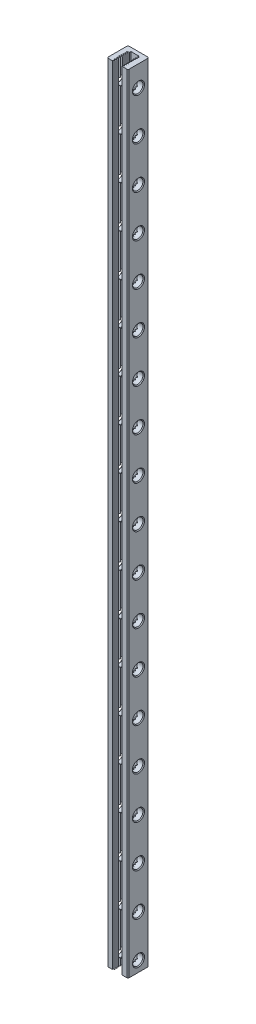
from build123d import *

# Parameters (mm, degrees)
SKETCH1_W                  = 8
SKETCH1_H                  = 8
BOSS_EXTRUDE1_DEPTH        = 300
CUT_EXTRUDE1_DEPTH         = 301.213257535
SKETCH3_R                  = 2
CUT_EXTRUDE2_DEPTH         = 301.213257535
CHAMFER1_SIZE              = 0.3
CHAMFER2_SIZE              = 0.3
LPATTERN1_COUNT            = 19
LPATTERN1_PITCH            = 16
CHAMFER1_OF_LPATTERN1_SIZE = 0.3


with BuildPart() as part:
    # Sketch1 → Boss-Extrude1 (new body)
    with BuildSketch(Plane(origin=(0, 0, 0), x_dir=(1, 0, 0), z_dir=(0, 1, 0))):
        with Locations((4, 4)):
            Rectangle(SKETCH1_W, SKETCH1_H)
    extrude(amount=BOSS_EXTRUDE1_DEPTH)

    # Sketch2 → Cut-Extrude1 (cut, through all)
    with BuildSketch(Plane.XZ):
        Polygon((5.652029979, 0), (2.008445554, 0), (2.008445554, -0.208206305), (2.54, -0.515099407), (1.673719601, -0.865099407), (2.54, -1.215099407), (1.673719601, -1.572712655), (2.54, -1.915099407), (1.673719601, -2.265099407), (2.54, -2.615099407), (1.673719601, -2.965099407), (2.54, -3.315099407), (1.673719601, -3.665099407), (2.54, -4.015099407), (1.673719601, -4.365099407), (2.54, -4.715099407), (1.673719601, -5.065099407), (2.54, -5.415099407), (1.673719601, -5.765099407), (2.54, -6.026380467), (2.54, -6.6), (5.46, -6.6), (5.46, -6.49878106), (6.106693316, -6.2375), (5.46, -5.8875), (6.106693316, -5.5375), (5.46, -5.1875), (6.106693316, -4.8375), (5.46, -4.4875), (6.106693316, -4.1375), (5.46, -3.7875), (6.106693316, -3.4375), (5.46, -3.0875), (6.106693316, -2.7375), (5.46, -2.3875), (6.106693316, -2.0375), (5.46, -1.6875), (6.106693316, -1.345113247), (5.46, -0.9875), (6.106693316, -0.6375), (5.652029979, -0.375), align=None)
    extrude(amount=-CUT_EXTRUDE1_DEPTH, mode=Mode.SUBTRACT)

    # Sketch3 → Cut-Extrude2 (cut, through all)
    with BuildSketch(Plane(origin=(8, 0, 0), x_dir=(0, 0, -1), z_dir=(1, 0, 0))):
        with Locations((4, 4)):
            Circle(SKETCH3_R)
    cut_extrude2 = extrude(amount=-CUT_EXTRUDE2_DEPTH, mode=Mode.SUBTRACT)

    # Chamfer1
    chamfer1_edges = [part.edges().sort_by_distance(p)[0] for p in [
        (0, 4, -2),
        (8, 4, -2),
    ]]
    chamfer(chamfer1_edges, length=CHAMFER1_SIZE)

    # Chamfer2
    chamfer2_edges = [part.edges().sort_by_distance(p)[0] for p in [
        (0, 150, -8),
        (8, 150, -8),
        (8, 150, 0),
        (0, 150, 0),
    ]]
    chamfer(chamfer2_edges, length=CHAMFER2_SIZE)

    # LPattern1: Cut-Extrude2 ×19
    with Locations(*[(0, i * LPATTERN1_PITCH, 0) for i in range(1, LPATTERN1_COUNT)]):
        add(cut_extrude2, mode=Mode.SUBTRACT)

    # Chamfer1 of LPattern1
    chamfer1_of_lpattern1_edges = [part.edges().sort_by_distance(p)[0] for p in [
        (0, 20, -2),
        (8, 20, -2),
        (0, 36, -2),
        (8, 36, -2),
        (0, 52, -2),
        (8, 52, -2),
        (0, 68, -2),
        (8, 68, -2),
        (0, 84, -2),
        (8, 84, -2),
        (0, 100, -2),
        (8, 100, -2),
        (0, 116, -2),
        (8, 116, -2),
        (0, 132, -2),
        (8, 132, -2),
        (0, 148, -2),
        (8, 148, -2),
        (0, 164, -2),
        (8, 164, -2),
        (0, 180, -2),
        (8, 180, -2),
        (0, 196, -2),
        (8, 196, -2),
        (0, 212, -2),
        (8, 212, -2),
        (0, 228, -2),
        (8, 228, -2),
        (0, 244, -2),
        (8, 244, -2),
        (0, 260, -2),
        (8, 260, -2),
        (0, 276, -2),
        (8, 276, -2),
        (0, 292, -2),
        (8, 292, -2),
    ]]
    chamfer(chamfer1_of_lpattern1_edges, length=CHAMFER1_OF_LPATTERN1_SIZE)


solid = part.part
